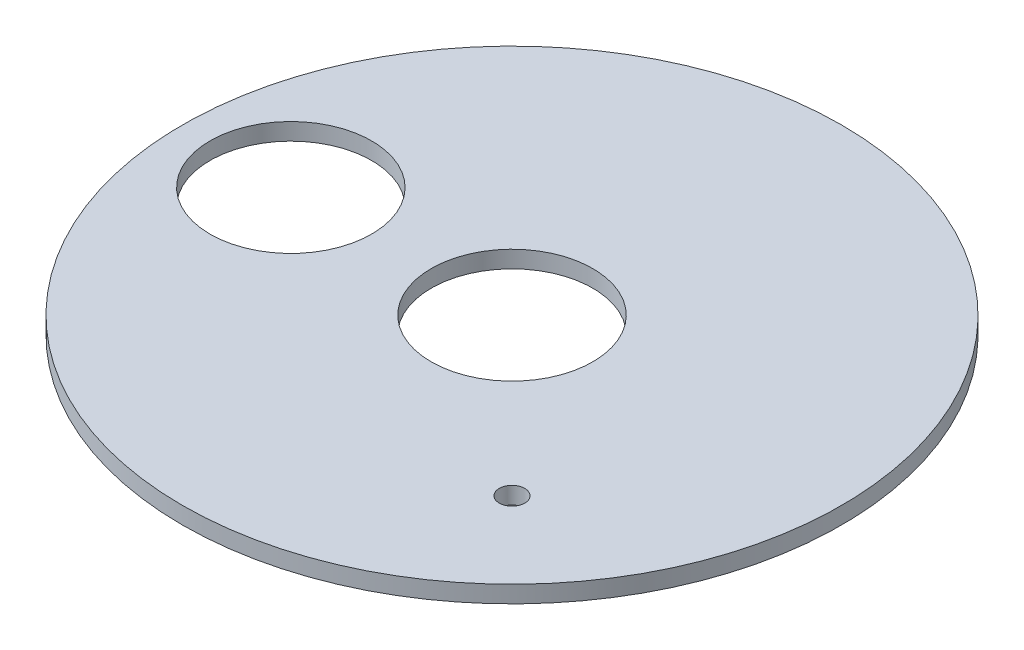
from build123d import *

# Parameters (mm, degrees)
SKETCH1_R           = 123
BOSS_EXTRUDE1_DEPTH = 6.35
SKETCH2_R           = 30.1625
CUT_EXTRUDE1_DEPTH  = 175.064133296
CUT_EXTRUDE2_REACH  = 176.064
SKETCH3_R           = 4.7625


with BuildPart() as part:
    # Sketch1 → Boss-Extrude1 (new body)
    with BuildSketch(Plane(origin=(0, 0, 0), x_dir=(1, 0, 0), z_dir=(0, 1, 0))):
        with Locations(Location((0, 0, 0), (0, 0, 270))):
            Circle(SKETCH1_R)
    extrude(amount=BOSS_EXTRUDE1_DEPTH)

    # Sketch2 → Cut-Extrude1 (cut, through all)
    with BuildSketch(Plane(origin=(0, 6.35, 0), x_dir=(1, 0, 0), z_dir=(0, 1, 0))):
        with Locations(Location((0, 0, 0), (0, 0, 270))):
            Circle(SKETCH2_R)
        with Locations(Location((-82.55, 0, 0), (0, 0, 270))):
            Circle(SKETCH2_R)
    extrude(amount=-CUT_EXTRUDE1_DEPTH, mode=Mode.SUBTRACT)

    # Sketch3 → Cut-Extrude2 (cut, up to next)
    with BuildSketch(Plane(origin=(0, 6.35, 0), x_dir=(1, 0, 0), z_dir=(0, 1, 0)), mode=Mode.PRIVATE) as cut_extrude2_sk1:
        with Locations(Location((58.371664787, -58.371664787, 0), (0, 0, 270))):
            Circle(SKETCH3_R)
    cut_extrude2_tool1 = extrude(cut_extrude2_sk1.sketch, amount=-CUT_EXTRUDE2_REACH, mode=Mode.PRIVATE) & part.part
    add(cut_extrude2_tool1.solids().sort_by_distance((58.371665, 6.35, 58.371665))[0], mode=Mode.SUBTRACT)


solid = part.part
